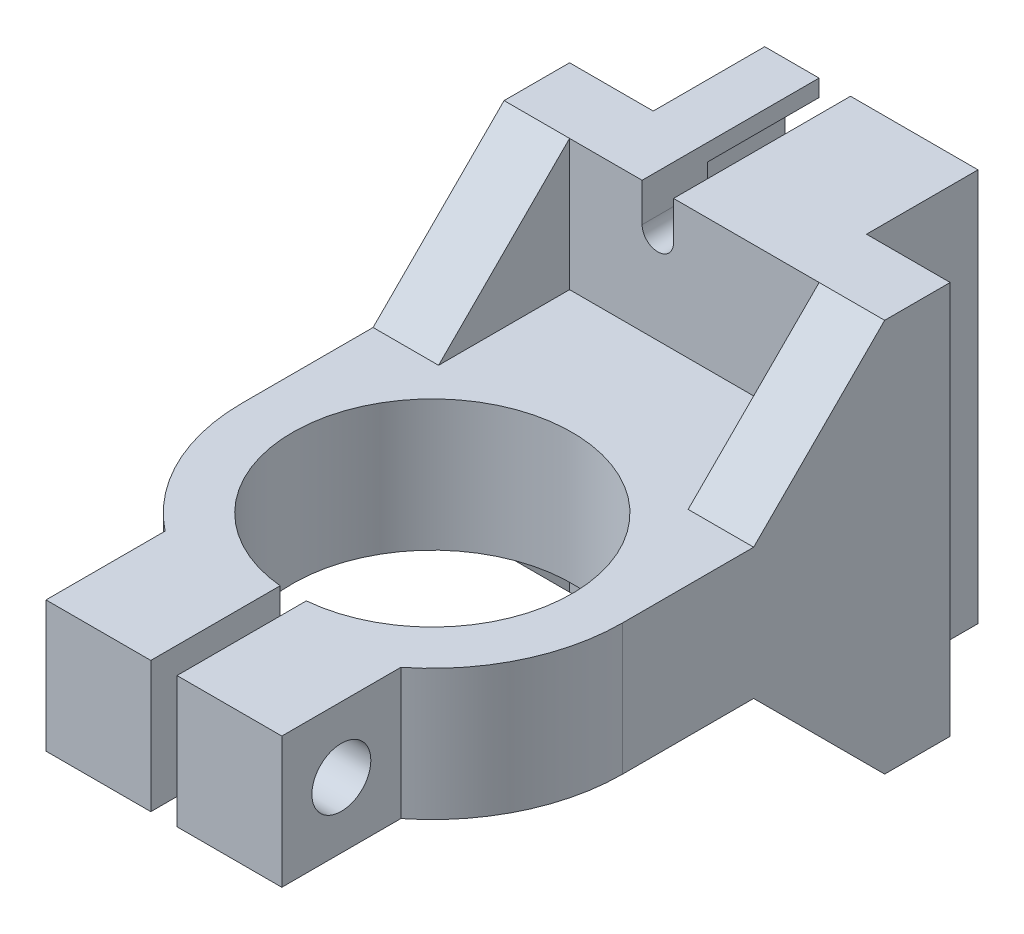
from build123d import *

# Parameters (mm, degrees)
CROQUIS1_R              = 10.668
SALIENTE_EXTRUIR1_DEPTH = 5
CROQUIS7_W              = 2
CROQUIS7_H              = 8
CORTAR_EXTRUIR5_DEPTH   = 44.28049503
SALIENTE_EXTRUIR3_DEPTH = 10
CORTAR_EXTRUIR6_REACH   = 53.457
CROQUIS9_R              = 2.25
SALIENTE_EXTRUIR4_DEPTH = 10
CROQUIS11_W             = 29.05
CROQUIS11_H             = 10
SALIENTE_EXTRUIR5_DEPTH = 5
CORTAR_EXTRUIR7_REACH   = 52.054
SALIENTE_EXTRUIR6_DEPTH = 8.51
CORTAR_EXTRUIR8_REACH   = 58.395
SALIENTE_EXTRUIR7_DEPTH = 5


with BuildPart() as part:
    # Croquis1 → Saliente-Extruir1 (new, symmetric)
    with BuildSketch(Plane(origin=(0, 0, 0), x_dir=(1, 0, 0), z_dir=(0, 1, 0))):
        with BuildLine():
            Line((14.525, 0), (-14.525, 0))
            Line((-14.525, 0), (-14.525, -10))
            Line((-14.525, -10), (-5, -10))
            Line((-5, -10), (-5, -11.362711963))
            ThreePointArc((-5, -11.362711963), (0, -39.525), (5, -11.362711963))
            Line((5, -11.362711963), (5, -10))
            Line((5, -10), (14.525, -10))
            Line((14.525, -10), (14.525, 0))
        make_face()
        with Locations(Location((0, -25, 0), (0, 0, 270))):
            Circle(CROQUIS1_R, mode=Mode.SUBTRACT)
    extrude(amount=SALIENTE_EXTRUIR1_DEPTH, both=True)

    # Croquis7 → Cortar-Extruir5 (cut, through all)
    with BuildSketch(Plane(origin=(0, 5, 0), x_dir=(1, 0, 0), z_dir=(0, 1, 0))):
        with Locations((0, -37.5965)):
            Rectangle(CROQUIS7_W, CROQUIS7_H)
    extrude(amount=-CORTAR_EXTRUIR5_DEPTH, mode=Mode.SUBTRACT)

    # Croquis8 → Saliente-Extruir3 (add)
    with BuildSketch(Plane(origin=(0, 5, 0), x_dir=(1, 0, 0), z_dir=(0, 1, 0))):
        with BuildLine():
            Line((-1, -39.490535704), (-1, -45.490535704))
            Line((-1, -45.490535704), (-9, -45.490535704))
            Line((-9, -45.490535704), (-9, -36.400685286))
            ThreePointArc((-9, -36.400685286), (-5.233239332, -38.549495603), (-1, -39.490535704))
        make_face()
        with BuildLine():
            Line((9, -45.490535704), (9, -36.400685286))
            ThreePointArc((9, -36.400685286), (5.233239332, -38.549495603), (1, -39.490535704))
            Line((1, -39.490535704), (1, -45.490535704))
            Line((1, -45.490535704), (9, -45.490535704))
        make_face()
    extrude(amount=-SALIENTE_EXTRUIR3_DEPTH)

    # Cortar-Extruir6: up to this face of the body (flat: up to its plane)
    cortar_extruir6_end = Plane(part.part.faces().sort_by_distance((-9, 0, 40.945610495))[0])
    # Croquis9 → Cortar-Extruir6 (cut, up to the picked face)
    with BuildSketch(Plane(origin=(9, 0, 0), x_dir=(0, 0, -1), z_dir=(1, 0, 0)), mode=Mode.PRIVATE) as cortar_extruir6_sk1:
        with Locations((-40.945610495, 0)):
            Circle(CROQUIS9_R)
    cortar_extruir6_tool1 = split(extrude(cortar_extruir6_sk1.sketch, amount=-CORTAR_EXTRUIR6_REACH, mode=Mode.PRIVATE), bisect_by=cortar_extruir6_end, keep=Keep.BOTH, mode=Mode.PRIVATE)
    add(cortar_extruir6_tool1.solids().sort_by(Axis((9, 0, 40.94561), (-1, 0, 0)))[0], mode=Mode.SUBTRACT)

    # Croquis10 → Saliente-Extruir4 (add)
    with BuildSketch(Plane(origin=(0, 5, 0), x_dir=(1, 0, 0), z_dir=(0, 1, 0))):
        with BuildLine():
            Line((-14.525, -10), (-14.525, -25))
            ThreePointArc((-14.525, -25), (-11.907993639, -16.682830259), (-5, -11.362711963))
            Line((-5, -11.362711963), (-5, -10))
            Line((-5, -10), (-14.525, -10))
        make_face()
        with BuildLine():
            Line((14.525, -10), (5, -10))
            Line((5, -10), (5, -11.362711963))
            ThreePointArc((5, -11.362711963), (11.907993639, -16.682830259), (14.525, -25))
            Line((14.525, -25), (14.525, -10))
        make_face()
    extrude(amount=-SALIENTE_EXTRUIR4_DEPTH)

    # Croquis11 → Saliente-Extruir5 (add)
    with BuildSketch(Plane(origin=(0, 0, 0), x_dir=(-1, 0, 0), z_dir=(0, 0, -1))):
        with Locations((0, 10)):
            Rectangle(CROQUIS11_W, CROQUIS11_H)
    saliente_extruir5 = extrude(amount=-SALIENTE_EXTRUIR5_DEPTH)

    # Croquis13 → Cortar-Extruir7 (cut, up to next)
    with BuildSketch(Plane(origin=(0, 0, 0), x_dir=(-1, 0, 0), z_dir=(0, 0, -1)), mode=Mode.PRIVATE) as cortar_extruir7_sk1:
        with BuildLine():
            Line((1.59, 12.065), (1.59, 15))
            Line((1.59, 15), (3.99, 15))
            Line((3.99, 15), (3.99, 12.065))
            ThreePointArc((3.99, 12.065), (2.79, 10.865), (1.59, 12.065))
        make_face()
    cortar_extruir7_tool1 = extrude(cortar_extruir7_sk1.sketch, amount=-CORTAR_EXTRUIR7_REACH, mode=Mode.PRIVATE) & part.part
    cortar_extruir7 = cortar_extruir7_tool1.solids().sort_by_distance((-2.79, 13.052011, 0))[0]
    add(cortar_extruir7, mode=Mode.SUBTRACT)

    # Simetría1: Saliente-Extruir5, Cortar-Extruir7 across plane
    add(saliente_extruir5.mirror(Plane.ZX))
    add(cortar_extruir7.mirror(Plane.ZX), mode=Mode.SUBTRACT)

    # Croquis14 → Saliente-Extruir6 (add)
    with BuildSketch(Plane(origin=(0, 0, 0), x_dir=(-1, 0, 0), z_dir=(0, 0, -1))):
        Polygon((1.59, -13.71), (-6.6, -13.71), (-6.6, 13.71), (1.59, 13.71), (1.59, 15), (-8.14, 15), (-8.14, -15), (1.59, -15), align=None)
        Polygon((6.6, -13.71), (3.99, -13.71), (3.99, -15), (8.14, -15), (8.14, 15), (3.99, 15), (3.99, 13.71), (6.6, 13.71), align=None)
    extrude(amount=SALIENTE_EXTRUIR6_DEPTH)

    # Croquis15 → Cortar-Extruir8 (cut, up to next)
    with BuildSketch(Plane.XZ.offset(15), mode=Mode.PRIVATE) as cortar_extruir8_sk1:
        with BuildLine():
            Line((4.29, -3.61), (4.29, -8.51))
            Line((4.29, -8.51), (-1.59, -8.51))
            Line((-1.59, -8.51), (-1.59, -0.85))
            Line((-1.59, -0.85), (1.53, -0.85))
            ThreePointArc((1.53, -0.85), (3.481614716, -1.658385284), (4.29, -3.61))
        make_face()
    cortar_extruir8_tool1 = extrude(cortar_extruir8_sk1.sketch, amount=-CORTAR_EXTRUIR8_REACH, mode=Mode.PRIVATE) & part.part
    add(cortar_extruir8_tool1.solids().sort_by_distance((1.262493, -15, -4.801026))[0], mode=Mode.SUBTRACT)

    # Croquis16 → Saliente-Extruir7 (add)
    with BuildSketch(Plane.ZY.offset(14.525)):
        Polygon((5, 15), (15, 5), (5, 5), align=None)
        Polygon((15, -5), (5, -5), (5, -15), align=None)
    saliente_extruir7 = extrude(amount=-SALIENTE_EXTRUIR7_DEPTH)

    # Simetría2: Saliente-Extruir7 across plane
    add(saliente_extruir7.mirror(Plane(origin=(0, 0, 0), x_dir=(0, 0, 1), z_dir=(1, 0, 0))))


solid = part.part
